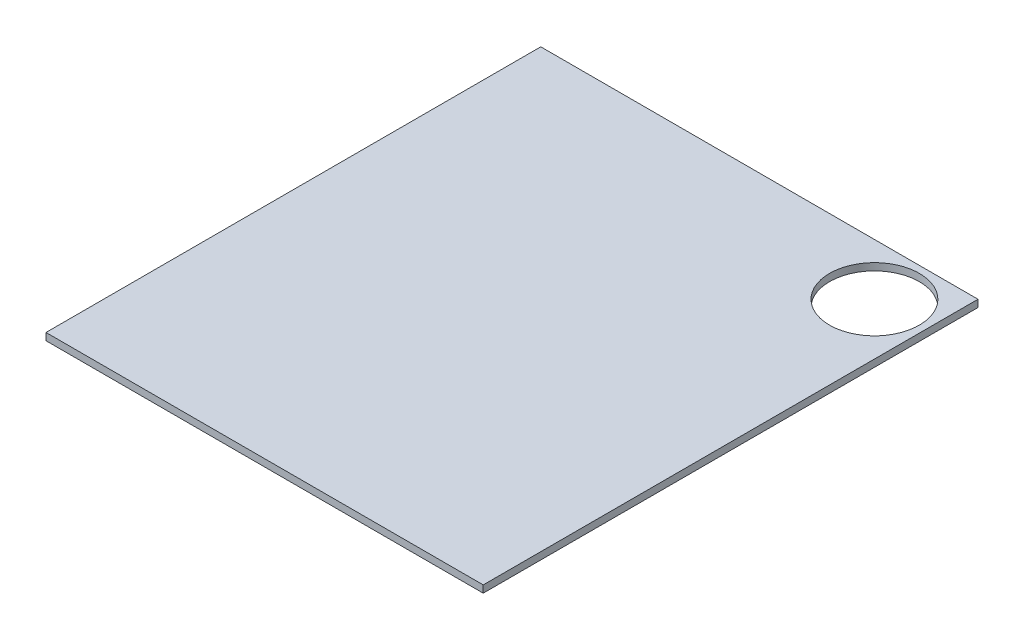
from build123d import *

# Parameters (mm, degrees)
BOSS_EXTRUDE1_DEPTH = 6.25


with BuildPart() as part:
    # Sketch1 → Boss-Extrude1 (new body)
    with BuildSketch(Plane(origin=(0, 0, 0), x_dir=(1, 0, 0), z_dir=(0, 1, 0))):
        with BuildLine():
            Line((106, 215), (106, 170))
            ThreePointArc((106, 170), (145, 209), (184, 170))
            Line((184, 170), (184, 215))
            Line((184, 215), (106, 215))
        make_face()
        with BuildLine():
            ThreePointArc((184, 170), (145, 131), (106, 170))
            Line((106, 170), (106, 215))
            Line((106, 215), (-190, 215))
            Line((-190, 215), (-190, -215))
            Line((-190, -215), (190, -215))
            Line((190, -215), (190, 215))
            Line((190, 215), (184, 215))
            Line((184, 215), (184, 170))
        make_face()
    extrude(amount=BOSS_EXTRUDE1_DEPTH)


solid = part.part
